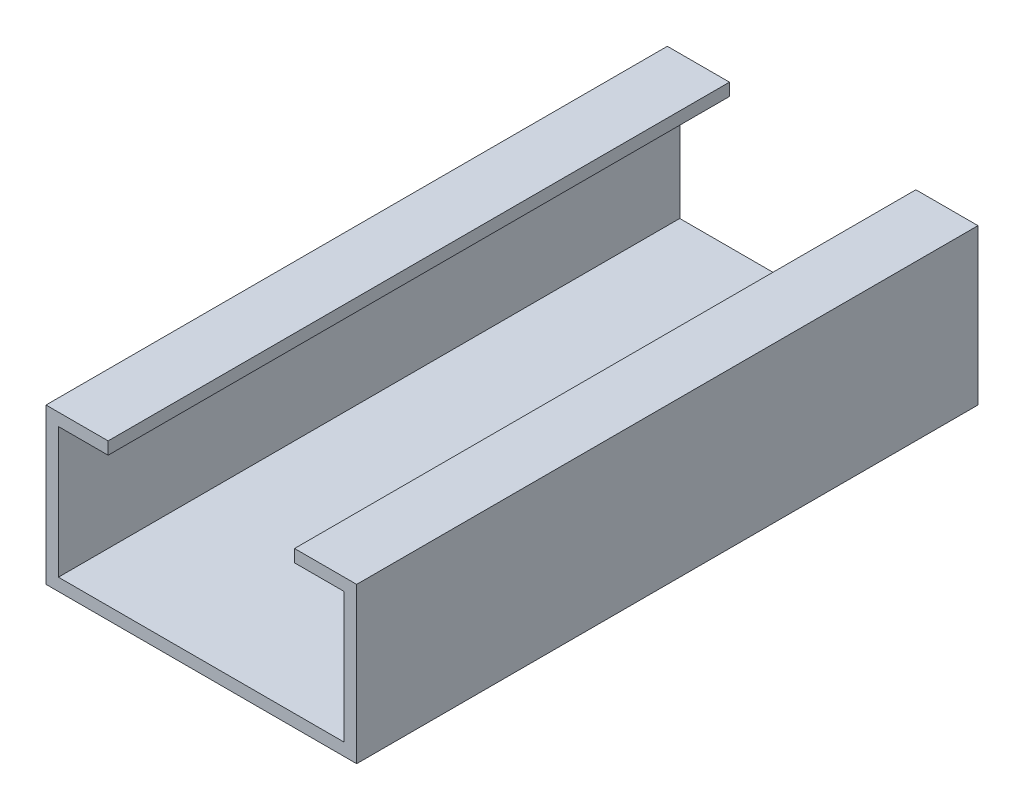
from build123d import *

# Parameters (mm, degrees)
BOSS_EXTRUDE1_DEPTH = 200


with BuildPart() as part:
    # Sketch1 → Boss-Extrude1 (new body)
    with BuildSketch(Plane.XY):
        Polygon((-30, 25), (-50, 25), (-50, -25), (50, -25), (50, 25), (30, 25), (30, 21), (46, 21), (46, -21), (-46, -21), (-46, 21), (-30, 21), align=None)
    extrude(amount=BOSS_EXTRUDE1_DEPTH)


solid = part.part
